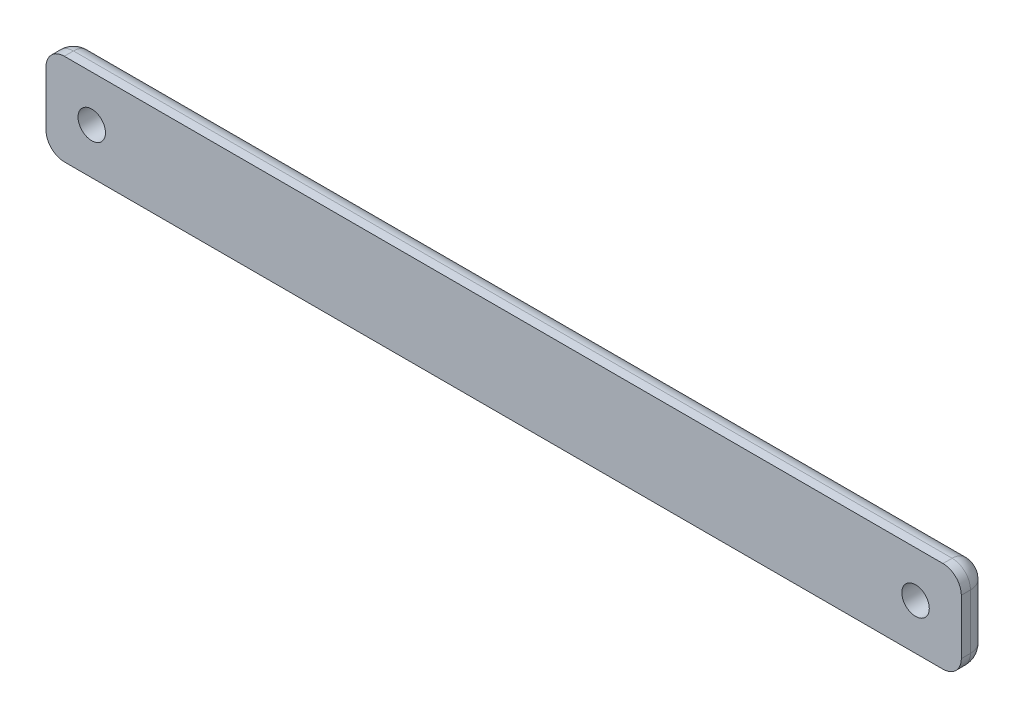
from build123d import *

# Parameters (mm, degrees)
SKETCH_1_W          = 100
SKETCH_1_H          = 10
EXTRUDE_1_DEPTH     = 1.5
SKETCH_2_R          = 1.5
CUT_EXTRUDE_1_DEPTH = 10
FILLET_1_R          = 2


with BuildPart() as part:
    # 草图1 → 凸台-拉伸1 (new, symmetric)
    with BuildSketch(Plane.XY):
        Rectangle(SKETCH_1_W, SKETCH_1_H)
    extrude(amount=EXTRUDE_1_DEPTH, both=True)

    # 草图2 → 切除-拉伸1 (cut)
    with BuildSketch(Plane.XY.offset(1.5)):
        with Locations((-45, 0)):
            Circle(SKETCH_2_R)
        with Locations((45, 0)):
            Circle(SKETCH_2_R)
    extrude(amount=-CUT_EXTRUDE_1_DEPTH, mode=Mode.SUBTRACT)

    # 圆角1
    fillet_1_edges = [part.edges().sort_by_distance(p)[0] for p in [
        (0, -5, -1.5),
        (-50, 0, -1.5),
        (0, 5, -1.5),
        (50, 0, -1.5),
        (50, -5, 0),
        (-50, -5, 0),
        (-50, 5, 0),
        (50, 5, 0),
    ]]
    fillet(fillet_1_edges, radius=FILLET_1_R)


solid = part.part
